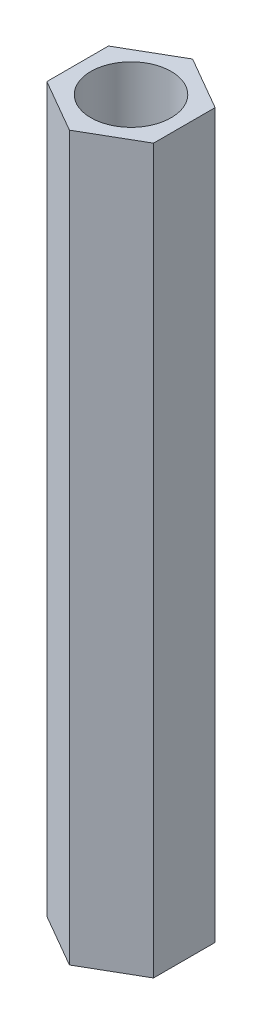
from build123d import *

# Parameters (mm, degrees)
SKETCH_1_R      = 1.5
EXTRUDE_1_DEPTH = 27


with BuildPart() as part:
    # 草图1 → 凸台-拉伸1 (new body)
    with BuildSketch(Plane(origin=(0, 0, 0), x_dir=(1, 0, 0), z_dir=(0, 1, 0))):
        Polygon((0, 2.3), (-1.991858429, 1.15), (-1.991858429, -1.15), (0, -2.3), (1.991858429, -1.15), (1.991858429, 1.15), align=None)
        with Locations(Location((0, 0, 0), (0, 0, 270))):
            Circle(SKETCH_1_R, mode=Mode.SUBTRACT)
    extrude(amount=EXTRUDE_1_DEPTH)


solid = part.part
